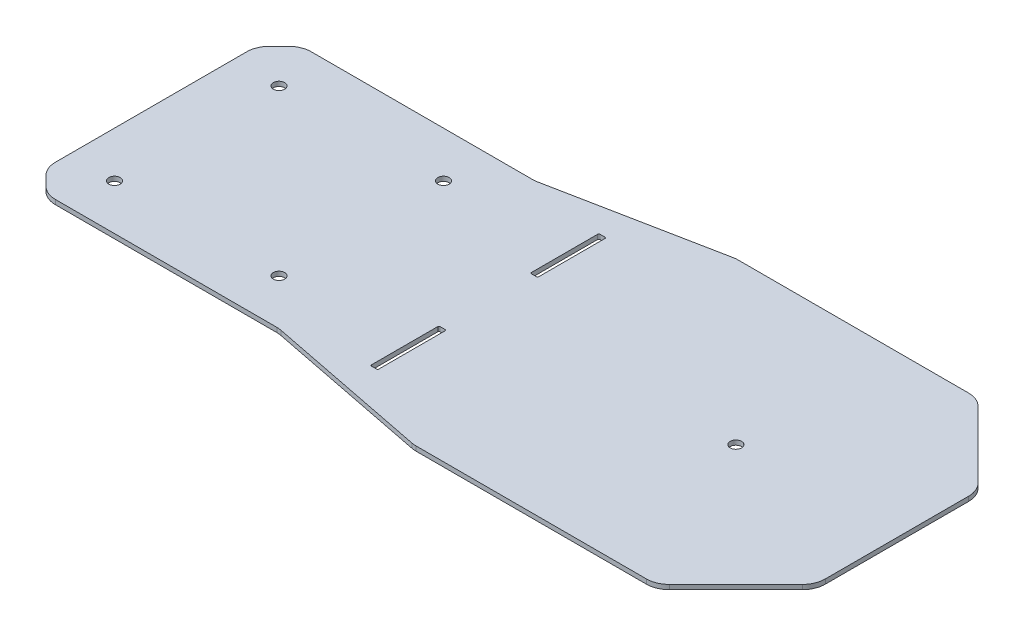
from build123d import *

# Parameters (mm, degrees)
BOSS_EXTRUDE1_DEPTH   = 2
CHAMFER1_SIZE         = 10
CHAMFER2_SIZE         = 35
FILLET1_R             = 10
F_5_0MM_DOWEL_HOLE1_D = 5
SKETCH5_R             = 2.5
CUT_EXTRUDE2_DEPTH    = 280.543377672
CUT_EXTRUDE3_DEPTH    = 280.543377672


with BuildPart() as part:
    # Sketch1 → Boss-Extrude1 (new body)
    with BuildSketch(Plane(origin=(0, 0, 0), x_dir=(1, 0, 0), z_dir=(0, 1, 0))):
        Polygon((56, 56), (129.5, 70.5), (270.5, 70.5), (270.5, -70.5), (129.5, -70.5), (56, -56), (-56, -56), (-56, 56), align=None)
    extrude(amount=BOSS_EXTRUDE1_DEPTH)

    # Chamfer1
    chamfer1_edges = [part.edges().sort_by_distance(p)[0] for p in [
        (-56, 1, 56),
        (-56, 1, -56),
    ]]
    chamfer(chamfer1_edges, length=CHAMFER1_SIZE)

    # Chamfer2
    chamfer2_edges = [part.edges().sort_by_distance(p)[0] for p in [
        (270.5, 1, 70.5),
        (270.5, 1, -70.5),
    ]]
    chamfer(chamfer2_edges, length=CHAMFER2_SIZE)

    # Fillet1
    fillet1_edges = [part.edges().sort_by_distance(p)[0] for p in [
        (129.5, 1, 70.5),
        (56, 1, 56),
        (56, 1, -56),
        (129.5, 1, -70.5),
        (-56, 1, 46),
        (-56, 1, -46),
        (-46, 1, -56),
        (-46, 1, 56),
        (235.5, 1, -70.5),
        (270.5, 1, 35.5),
        (270.5, 1, -35.5),
        (235.5, 1, 70.5),
    ]]
    fillet(fillet1_edges, radius=FILLET1_R)

    # Ø5.0mm Dowel Hole1 (through all)
    with Locations(Plane(origin=(0, 0, 0), x_dir=(-1, 0, 0), z_dir=(0, -1, 0))):
        with Locations((36, -36), (-36, -36), (36, 36), (-36, 36)):
            Hole(F_5_0MM_DOWEL_HOLE1_D / 2)

    # Sketch5 → Cut-Extrude2 (cut, through all)
    with BuildSketch(Plane(origin=(0, 2, 0), x_dir=(1, 0, 0), z_dir=(0, 1, 0))):
        with Locations(Location((200, 0, 0), (0, 0, 270))):
            Circle(SKETCH5_R)
    extrude(amount=-CUT_EXTRUDE2_DEPTH, mode=Mode.SUBTRACT)

    # Sketch6 → Cut-Extrude3 (cut, through all)
    with BuildSketch(Plane(origin=(0, 2, 0), x_dir=(1, 0, 0), z_dir=(0, 1, 0))):
        with BuildLine():
            Line((93.2, 20.5), (93.2, 49.5))
            ThreePointArc((93.2, 49.5), (93.053553391, 49.853553391), (92.7, 50))
            Line((92.7, 50), (90.5, 50))
            ThreePointArc((90.5, 50), (90.146446609, 49.853553391), (90, 49.5))
            Line((90, 49.5), (90, 20.5))
            ThreePointArc((90, 20.5), (90.146446609, 20.146446609), (90.5, 20))
            Line((90.5, 20), (92.7, 20))
            ThreePointArc((92.7, 20), (93.053553391, 20.146446609), (93.2, 20.5))
        make_face()
        with BuildLine():
            Line((90.5, -20), (92.7, -20))
            ThreePointArc((92.7, -20), (93.053553391, -20.146446609), (93.2, -20.5))
            Line((93.2, -20.5), (93.2, -49.5))
            ThreePointArc((93.2, -49.5), (93.053553391, -49.853553391), (92.7, -50))
            Line((92.7, -50), (90.5, -50))
            ThreePointArc((90.5, -50), (90.146446609, -49.853553391), (90, -49.5))
            Line((90, -49.5), (90, -20.5))
            ThreePointArc((90, -20.5), (90.146446609, -20.146446609), (90.5, -20))
        make_face()
    extrude(amount=-CUT_EXTRUDE3_DEPTH, mode=Mode.SUBTRACT)


solid = part.part
